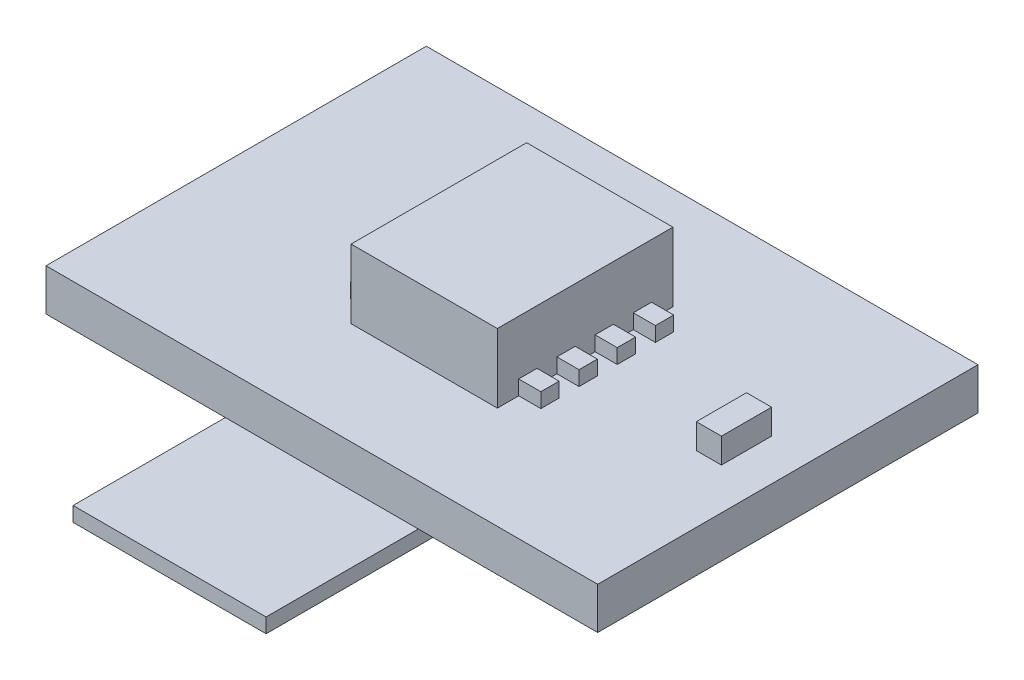
from build123d import *

# Parameters (mm, degrees)
SKETCH1_W           = 13.2
SKETCH1_H           = 9.1
BOSS_EXTRUDE1_DEPTH = 1
SKETCH2_W           = 3.5
SKETCH2_H           = 4.2
BOSS_EXTRUDE2_DEPTH = 1.65
SKETCH3_W           = 0.6
SKETCH3_H           = 1.2
BOSS_EXTRUDE3_DEPTH = 0.6
SKETCH4_W           = 4.618980196
SKETCH4_H           = 7.488452384
BOSS_EXTRUDE4_DEPTH = 0.35
SKETCH5_W           = 0.529853481
SKETCH5_H           = 0.437759734
SKETCH5_H_2         = 0.437759735
BOSS_EXTRUDE5_DEPTH = 1.35


with BuildPart() as part:
    # Sketch1 → Boss-Extrude1 (new body)
    with BuildSketch(Plane(origin=(0, 0, 0), x_dir=(1, 0, 0), z_dir=(0, 1, 0))):
        Rectangle(SKETCH1_W, SKETCH1_H)
    extrude(amount=BOSS_EXTRUDE1_DEPTH)

    # Sketch2 → Boss-Extrude2 (add)
    with BuildSketch(Plane(origin=(0, 1, 0), x_dir=(1, 0, 0), z_dir=(0, 1, 0))):
        Rectangle(SKETCH2_W, SKETCH2_H)
    extrude(amount=BOSS_EXTRUDE2_DEPTH)

    # Sketch3 → Boss-Extrude3 (add)
    with BuildSketch(Plane(origin=(0, 1, 0), x_dir=(1, 0, 0), z_dir=(0, 1, 0))):
        with Locations((5.310699057, 0)):
            Rectangle(SKETCH3_W, SKETCH3_H)
    extrude(amount=BOSS_EXTRUDE3_DEPTH)

    # Sketch4 → Boss-Extrude4 (add)
    with BuildSketch(Plane.XZ):
        with Locations((0, 4.449008393)):
            Rectangle(SKETCH4_W, SKETCH4_H)
    extrude(amount=BOSS_EXTRUDE4_DEPTH)

    # Sketch5 → Boss-Extrude5 (add)
    with BuildSketch(Plane(origin=(0, 0, 0), x_dir=(1, 0, 0), z_dir=(0, 1, 0))):
        with Locations((-2.01492674, 1.370758696)):
            Rectangle(SKETCH5_W, SKETCH5_H)
        with Locations((-2.01492674, 0.456919566)):
            Rectangle(SKETCH5_W, SKETCH5_H_2)
        with Locations((2.01492674, 0.456919566)):
            Rectangle(SKETCH5_W, SKETCH5_H_2)
        with Locations((2.01492674, 1.370758696)):
            Rectangle(SKETCH5_W, SKETCH5_H)
        with Locations((2.01492674, -1.370758696)):
            Rectangle(SKETCH5_W, SKETCH5_H)
        with Locations((2.01492674, -0.456919566)):
            Rectangle(SKETCH5_W, SKETCH5_H_2)
        with Locations((-2.01492674, -0.456919566)):
            Rectangle(SKETCH5_W, SKETCH5_H_2)
        with Locations((-2.01492674, -1.370758696)):
            Rectangle(SKETCH5_W, SKETCH5_H)
    extrude(amount=BOSS_EXTRUDE5_DEPTH)


solid = part.part
